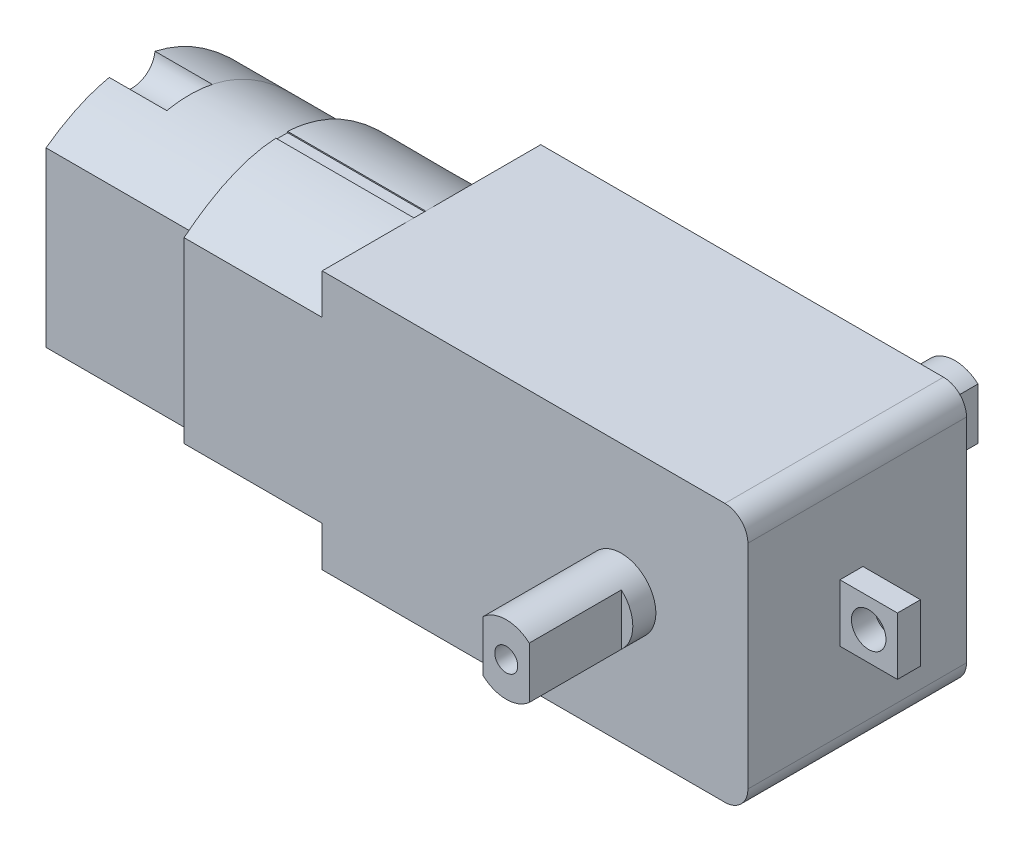
from build123d import *
from build123d.topology import SkipClean

# Parameters (mm, degrees)
ESQUISSE1_W             = 37
ESQUISSE1_H             = 19
BOSS_EXTRU_1_DEPTH      = 22.5
ESQUISSE2_W             = 2
ESQUISSE2_H             = 2.5
BOSS_EXTRU_2_DEPTH      = 5
ESQUISSE3_R             = 1.5
ENL_V_MAT_EXTRU_1_DEPTH = 2.410935021
BOSS_EXTRU_3_DEPTH      = 12
BOSS_EXTRU_4_DEPTH      = 8
BOSS_EXTRU_5_DEPTH      = 5
BOSS_EXTRU_6_DEPTH      = 2
BOSS_EXTRU_8_DEPTH      = 1
ENL_V_MAT_EXTRU_2_DEPTH = 1
BOSS_EXTRU_11_DEPTH     = 10
ENL_V_START             = -8
ENL_V_MAT_EXTRU_3_DEPTH = 8
ESQUISSE20_R            = 1
ENL_V_MAT_EXTRU_4_DEPTH = 12
BOSS_EXTRU_12_START     = 10
ESQUISSE21_R            = 3
BOSS_EXTRU_12_DEPTH     = 10
ENL_V_START_2           = -12
ESQUISSE22_R            = 1
ENL_V_MAT_EXTRU_5_DEPTH = 12
ENL_V_MAT_EXTRU_6_DEPTH = 8
CONG_1_R                = 2
CONG_2_R                = 2
ESQUISSE25_W            = 12
ESQUISSE25_H            = 1.024916904
ENL_V_MAT_EXTRU_8_DEPTH = 0.1
ESQUISSE26_W            = 12
ESQUISSE26_H            = 1.024916904
ENL_V_MAT_EXTRU_9_DEPTH = 0.1


with BuildPart() as part:
    # Esquisse1 → Boss.-Extru.1 (new body)
    with BuildSketch(Plane(origin=(0, 0, 0), x_dir=(1, 0, 0), z_dir=(0, 1, 0))):
        with Locations((18.5, 9.5)):
            Rectangle(ESQUISSE1_W, ESQUISSE1_H)
    extrude(amount=BOSS_EXTRU_1_DEPTH)

    # Esquisse2 → Boss.-Extru.2 (add)
    with BuildSketch(Plane(origin=(37, 0, 0), x_dir=(0, 0, -1), z_dir=(1, 0, 0))):
        with Locations((9, 10)):
            Rectangle(ESQUISSE2_W, ESQUISSE2_H)
        with Locations((9, 12.5)):
            Rectangle(ESQUISSE2_W, ESQUISSE2_H)
    extrude(amount=BOSS_EXTRU_2_DEPTH)

    # Esquisse3 → Enlèv. mat.-Extru.1 (cut)
    with BuildSketch(Plane.XY.offset(-8)):
        with Locations((39.5, 11.25)):
            Circle(ESQUISSE3_R)
    extrude(amount=-ENL_V_MAT_EXTRU_1_DEPTH, mode=Mode.SUBTRACT)

    # Esquisse4 → Boss.-Extru.3 (add)
    with BuildSketch(Plane.ZY):
        with BuildLine():
            Line((-17, 18.52996288), (-17, 17.52996288))
            add(Edge.make_bspline(
                [(-17, 17.52996288), (-13.120467928, 21.281137839), (-9, 21.5)],
                knots=[0.059122434, 0.059122434, 0.059122434, 0.5160139, 0.5160139, 0.5160139], degree=2))
            Line((-9, 21.5), (-9, 22.5))
            add(Edge.make_bspline(
                [(-17, 18.52996288), (-13.120467928, 22.281137839), (-9, 22.5)],
                knots=[0.059122434, 0.059122434, 0.059122434, 0.5160139, 0.5160139, 0.5160139], degree=2))
        make_face()
        with BuildLine():
            add(Edge.make_bspline(
                [(-9, 21.5), (-5.107506367, 21.706753112), (-1, 18.761247174)],
                knots=[0.5160139, 0.5160139, 0.5160139, 0.947626804, 0.947626804, 0.947626804], degree=2))
            Line((-1, 18.761247174), (-1, 19.761247174))
            add(Edge.make_bspline(
                [(-7.975083096, 22.5), (-4.568692956, 22.320368294), (-1, 19.761247174)],
                knots=[0.572631907, 0.572631907, 0.572631907, 0.947626804, 0.947626804, 0.947626804], degree=2))
            Line((-7.975083096, 22.5), (-9, 22.5))
            Line((-9, 22.5), (-9, 21.5))
        make_face()
        with BuildLine():
            Line((-1, 19.761247174), (-1, 18.761247174))
            add(Edge.make_bspline(
                [(-1, 18.761247174), (-0.501582937, 18.403830705), (0, 18)],
                knots=[0.947626804, 0.947626804, 0.947626804, 1, 1, 1], degree=2))
            Line((0, 18), (0, 19))
            add(Edge.make_bspline(
                [(-1, 19.761247174), (-0.501582937, 19.403830705), (0, 19)],
                knots=[0.947626804, 0.947626804, 0.947626804, 1, 1, 1], degree=2))
        make_face()
        with BuildLine():
            Line((-1, 18.761247174), (-1, 3.738752826))
            add(Edge.make_bspline(
                [(-1, 3.738752826), (-0.501582937, 4.096169295), (0, 4.5)],
                knots=[0.947626804, 0.947626804, 0.947626804, 1, 1, 1], degree=2))
            Line((0, 4.5), (0, 18))
            add(Edge.make_bspline(
                [(-1, 18.761247174), (-0.501582937, 18.403830705), (0, 18)],
                knots=[0.947626804, 0.947626804, 0.947626804, 1, 1, 1], degree=2))
        make_face()
        with BuildLine():
            Line((-9, 1), (-9, 0))
            Line((-9, 0), (-7.975083096, 0))
            add(Edge.make_bspline(
                [(-7.975083096, 0), (-4.568692956, 0.179631706), (-1, 2.738752826)],
                knots=[0.572631907, 0.572631907, 0.572631907, 0.947626804, 0.947626804, 0.947626804], degree=2))
            Line((-1, 2.738752826), (-1, 3.738752826))
            add(Edge.make_bspline(
                [(-9, 1), (-5.107506367, 0.793246888), (-1, 3.738752826)],
                knots=[0.5160139, 0.5160139, 0.5160139, 0.947626804, 0.947626804, 0.947626804], degree=2))
        make_face()
        with BuildLine():
            add(Edge.make_bspline(
                [(-1, 3.738752826), (-0.501582937, 4.096169295), (0, 4.5)],
                knots=[0.947626804, 0.947626804, 0.947626804, 1, 1, 1], degree=2))
            Line((-1, 3.738752826), (-1, 2.738752826))
            add(Edge.make_bspline(
                [(-1, 2.738752826), (-0.501582937, 3.096169295), (0, 3.5)],
                knots=[0.947626804, 0.947626804, 0.947626804, 1, 1, 1], degree=2))
            Line((0, 3.5), (0, 4.5))
        make_face()
        with BuildLine():
            add(Edge.make_bspline(
                [(-17, 3.97003712), (-13.120467928, 0.218862161), (-9, 0)],
                knots=[0.059122434, 0.059122434, 0.059122434, 0.5160139, 0.5160139, 0.5160139], degree=2))
            Line((-9, 0), (-9, 1))
            add(Edge.make_bspline(
                [(-17, 4.97003712), (-13.120467928, 1.218862161), (-9, 1)],
                knots=[0.059122434, 0.059122434, 0.059122434, 0.5160139, 0.5160139, 0.5160139], degree=2))
            Line((-17, 4.97003712), (-17, 3.97003712))
        make_face()
        with BuildLine():
            Line((-18, 6), (-18, 5))
            add(Edge.make_bspline(
                [(-18, 5), (-17.502017205, 4.455444723), (-17, 3.97003712)],
                knots=[0, 0, 0, 0.059122434, 0.059122434, 0.059122434], degree=2))
            Line((-17, 3.97003712), (-17, 4.97003712))
            add(Edge.make_bspline(
                [(-18, 6), (-17.502017205, 5.455444723), (-17, 4.97003712)],
                knots=[0, 0, 0, 0.059122434, 0.059122434, 0.059122434], degree=2))
        make_face()
        with BuildLine():
            Line((-18, 16.5), (-18, 6))
            add(Edge.make_bspline(
                [(-18, 6), (-17.502017205, 5.455444723), (-17, 4.97003712)],
                knots=[0, 0, 0, 0.059122434, 0.059122434, 0.059122434], degree=2))
            Line((-17, 4.97003712), (-17, 17.52996288))
            add(Edge.make_bspline(
                [(-18, 16.5), (-17.502017205, 17.044555277), (-17, 17.52996288)],
                knots=[0, 0, 0, 0.059122434, 0.059122434, 0.059122434], degree=2))
        make_face()
        with BuildLine():
            Line((-18, 17.5), (-18, 16.5))
            add(Edge.make_bspline(
                [(-18, 16.5), (-17.502017205, 17.044555277), (-17, 17.52996288)],
                knots=[0, 0, 0, 0.059122434, 0.059122434, 0.059122434], degree=2))
            Line((-17, 17.52996288), (-17, 18.52996288))
            add(Edge.make_bspline(
                [(-18, 17.5), (-17.502017205, 18.044555277), (-17, 18.52996288)],
                knots=[0, 0, 0, 0.059122434, 0.059122434, 0.059122434], degree=2))
        make_face()
    extrude(amount=BOSS_EXTRU_3_DEPTH)

    # Esquisse15 → Boss.-Extru.11 (add)
    with BuildSketch(Plane(origin=(0, 0, -19), x_dir=(-1, 0, 0), z_dir=(0, 0, -1))):
        with BuildLine():
            Line((-27.1, 14.041057147), (-27.1, 11.25))
            Line((-27.1, 11.25), (-26, 11.25))
            Line((-26, 11.25), (-24.9, 11.25))
            Line((-24.9, 11.25), (-24.9, 14.041057147))
            ThreePointArc((-24.9, 14.041057147), (-26, 14.25), (-27.1, 14.041057147))
        make_face()
        with BuildLine():
            Line((-26, 11.25), (-27.1, 11.25))
            Line((-27.1, 11.25), (-27.1, 8.458942853))
            ThreePointArc((-27.1, 8.458942853), (-26, 8.25), (-24.9, 8.458942853))
            Line((-24.9, 8.458942853), (-24.9, 11.25))
            Line((-24.9, 11.25), (-26, 11.25))
        make_face()
        with BuildLine():
            ThreePointArc((-23, 11.25), (-23.520080646, 12.938194302), (-24.9, 14.041057147))
            Line((-24.9, 14.041057147), (-24.9, 11.25))
            Line((-24.9, 11.25), (-24.9, 8.458942853))
            ThreePointArc((-24.9, 8.458942853), (-23.520080646, 9.561805698), (-23, 11.25))
        make_face()
        with BuildLine():
            ThreePointArc((-27.1, 14.041057147), (-28.479919354, 12.938194302), (-29, 11.25))
            Line((-29, 11.25), (-27.1, 11.25))
            Line((-27.1, 11.25), (-27.1, 14.041057147))
        make_face()
        with BuildLine():
            Line((-27.1, 11.25), (-29, 11.25))
            ThreePointArc((-29, 11.25), (-28.479919354, 9.561805698), (-27.1, 8.458942853))
            Line((-27.1, 8.458942853), (-27.1, 11.25))
        make_face()
    extrude(amount=BOSS_EXTRU_11_DEPTH)

    # Esquisse19 → Enlèv. mat.-Extru.3 (cut)
    with BuildSketch(Plane(origin=(0, 0, -29), x_dir=(-1, 0, 0), z_dir=(0, 0, -1)).offset(ENL_V_START)):
        with BuildLine():
            ThreePointArc((-23, 11.25), (-23.261387212, 12.474744871), (-24, 13.486067977))
            Line((-24, 13.486067977), (-24, 9.013932023))
            ThreePointArc((-24, 9.013932023), (-23.261387212, 10.025255129), (-23, 11.25))
        make_face()
        with BuildLine():
            Line((-28, 9.013932023), (-28, 13.486067977))
            ThreePointArc((-28, 13.486067977), (-29, 11.25), (-28, 9.013932023))
        make_face()
    extrude(amount=ENL_V_MAT_EXTRU_3_DEPTH, mode=Mode.SUBTRACT)

    # Esquisse20 → Enlèv. mat.-Extru.4 (cut)
    with BuildSketch(Plane(origin=(0, 0, -29), x_dir=(-1, 0, 0), z_dir=(0, 0, -1))):
        with Locations((-26, 11.25)):
            Circle(ESQUISSE20_R)
    extrude(amount=-ENL_V_MAT_EXTRU_4_DEPTH, mode=Mode.SUBTRACT)

    # Esquisse21 → Boss.-Extru.12 (add)
    with BuildSketch(Plane.XY.offset(BOSS_EXTRU_12_START)):
        with Locations((26, 11.25)):
            Circle(ESQUISSE21_R)
    extrude(amount=-BOSS_EXTRU_12_DEPTH)

    # Esquisse22 → Enlèv. mat.-Extru.5 (cut)
    with BuildSketch(Plane.XY.offset(10).offset(ENL_V_START_2)):
        with Locations(Location((26, 11.25, 0), (0, 0, 180))):
            Circle(ESQUISSE22_R)
    extrude(amount=ENL_V_MAT_EXTRU_5_DEPTH, mode=Mode.SUBTRACT)

    # Esquisse23 → Enlèv. mat.-Extru.6 (cut)
    with BuildSketch(Plane.XY.offset(10)):
        with BuildLine():
            Line((28, 13.486067977), (28, 11.25))
            Line((28, 11.25), (28, 9.013932023))
            ThreePointArc((28, 9.013932023), (28.738612788, 10.025255129), (29, 11.25))
            ThreePointArc((29, 11.25), (28.738612788, 12.474744871), (28, 13.486067977))
        make_face()
        with BuildLine():
            Line((24, 9.013932023), (24, 11.25))
            Line((24, 11.25), (24, 13.486067977))
            ThreePointArc((24, 13.486067977), (23, 11.25), (24, 9.013932023))
        make_face()
    extrude(amount=-ENL_V_MAT_EXTRU_6_DEPTH, mode=Mode.SUBTRACT)

    # Congé1
    cong_1_edges = [part.edges().sort_by_distance(p)[0] for p in [
        (37, 22.5, -9.5),
    ]]
    fillet(cong_1_edges, radius=CONG_1_R)

    # Congé2
    cong_2_edges = [part.edges().sort_by_distance(p)[0] for p in [
        (37, 0, -9.5),
    ]]
    fillet(cong_2_edges, radius=CONG_2_R)

    # Esquisse25 → Enlèv. mat.-Extru.8 (cut)
    with BuildSketch(Plane.XZ):
        with Locations((-6, -8.487541548)):
            Rectangle(ESQUISSE25_W, ESQUISSE25_H)
    extrude(amount=-ENL_V_MAT_EXTRU_8_DEPTH, mode=Mode.SUBTRACT)

    # Esquisse26 → Enlèv. mat.-Extru.9 (cut)
    with BuildSketch(Plane(origin=(0, 22.5, 0), x_dir=(1, 0, 0), z_dir=(0, 1, 0))):
        with Locations((-6, 8.487541548)):
            Rectangle(ESQUISSE26_W, ESQUISSE26_H)
    extrude(amount=-ENL_V_MAT_EXTRU_9_DEPTH, mode=Mode.SUBTRACT)


with BuildPart() as body_2:
    # Esquisse9 → Boss.-Extru.4 (new body)
    with BuildSketch(Plane.ZY.offset(12)):
        with BuildLine():
            add(Edge.make_bspline(
                [(-1, 18.761247174), (-9.455579824, 24.82477048), (-17, 17.52996288)],
                knots=[0.544374, 0.544374, 0.544374, 1.43287837, 1.43287837, 1.43287837], degree=2))
            Line((-17, 17.52996288), (-17, 4.97003712))
            add(Edge.make_bspline(
                [(-17, 4.97003712), (-9.455579824, -2.32477048), (-1, 3.738752826)],
                knots=[0.059122434, 0.059122434, 0.059122434, 0.947626804, 0.947626804, 0.947626804], degree=2))
            Line((-1, 3.738752826), (-1, 18.761247174))
        make_face()
    extrude(amount=BOSS_EXTRU_4_DEPTH)

    # Esquisse10 → Boss.-Extru.5 (add)
    with BuildSketch(Plane.ZY.offset(20)):
        with BuildLine():
            add(Edge.make_bspline(
                [(-1, 18.761247174), (-3.797616827, 20.767427138), (-6.495490257, 21.311288945)],
                knots=[0.544374, 0.544374, 0.544374, 0.838344943, 0.838344943, 0.838344943], degree=2))
            add(Edge.make_bspline(
                [(-6.495490257, 21.311288945), (-6.496620171, 21.311516723), (-6.497750067, 21.311744245)],
                knots=[0.838344943, 0.838344943, 0.838344943, 0.838468063, 0.838468063, 0.838468063], degree=2))
            ThreePointArc((-6.497750067, 21.311744245), (-8.4763836, 19.513591784), (-10.474957342, 21.289555163))
            add(Edge.make_bspline(
                [(-17.000000003, 17.529962878), (-13.787011803, 20.568477856), (-10.474957342, 21.289555163)],
                knots=[0, 0, 0, 0.416489775, 0.416489775, 0.416489775], degree=2))
            Line((-17, 17.52996288), (-17, 11.25))
            Line((-17, 11.25), (-17, 4.970037121))
            add(Edge.make_bspline(
                [(-17, 4.970037125), (-13.788104816, 1.932555806), (-10.47721076, 1.210935706)],
                knots=[0, 0, 0, 0.416348091, 0.416348091, 0.416348091], degree=2))
            ThreePointArc((-10.47721076, 1.210935706), (-8.476365575, 2.988702384), (-6.495490257, 1.188711053))
            add(Edge.make_bspline(
                [(-6.495490257, 1.188711055), (-3.797616827, 1.732572862), (-1, 3.738752826)],
                knots=[0.653655861, 0.653655861, 0.653655861, 0.947626804, 0.947626804, 0.947626804], degree=2))
            Line((-1, 3.738752825), (-1.000000001, 11.25))
            Line((-1.000000001, 11.25), (-1.000000001, 18.761247174))
        make_face()
    extrude(amount=BOSS_EXTRU_5_DEPTH)

    # Esquisse11 → Boss.-Extru.6 (add)
    with BuildSketch(Plane.ZY.offset(25)):
        with BuildLine():
            Line((-12.000000003, 14.798549504), (-12.000000003, 11.25))
            Line((-12.000000003, 11.25), (-12.000000003, 7.703744664))
            ThreePointArc((-12.000000003, 7.703744664), (-6.555193581, 6.634972961), (-3.476374588, 11.251147084))
            ThreePointArc((-3.476374588, 11.251147084), (-6.555193581, 15.867321208), (-12.000000003, 14.798549504))
        make_face()
    extrude(amount=BOSS_EXTRU_6_DEPTH)

    # Esquisse13 → Boss.-Extru.8 (add)
    with BuildSketch(Plane.ZY.offset(27)):
        with BuildLine():
            ThreePointArc((-9.487541548, 11.25), (-9.194648329, 10.542893219), (-8.487541548, 10.25))
            Line((-8.487541548, 10.25), (-8.487541548, 11.25))
            Line((-8.487541548, 11.25), (-9.487541548, 11.25))
        make_face()
        with BuildLine():
            Line((-8.487541548, 11.25), (-8.487541548, 10.25))
            ThreePointArc((-8.487541548, 10.25), (-7.780434767, 10.542893219), (-7.487541548, 11.25))
            Line((-7.487541548, 11.25), (-8.487541548, 11.25))
        make_face()
        with BuildLine():
            Line((-9.487541548, 11.25), (-8.487541548, 11.25))
            Line((-8.487541548, 11.25), (-8.487541548, 12.25))
            ThreePointArc((-8.487541548, 12.25), (-9.194648329, 11.957106781), (-9.487541548, 11.25))
        make_face()
        with BuildLine():
            Line((-8.487541548, 12.25), (-8.487541548, 11.25))
            Line((-8.487541548, 11.25), (-7.487541548, 11.25))
            ThreePointArc((-7.487541548, 11.25), (-7.780434767, 11.957106781), (-8.487541548, 12.25))
        make_face()
    extrude(amount=BOSS_EXTRU_8_DEPTH)

    # Esquisse14 → Enlèv. mat.-Extru.2 (cut)
    with SkipClean():  # the faces are left unmerged after this step: merging them gives an invalid solid
        with BuildSketch(Plane.ZY.offset(27)):
            with BuildLine():
                ThreePointArc((-8.487541548, 12.25), (-7.780434767, 11.957106781), (-7.487541548, 11.25))
                Line((-7.487541548, 11.25), (-6.487541548, 11.25))
                ThreePointArc((-6.487541548, 11.25), (-7.073327985, 12.664213562), (-8.487541548, 13.25))
                Line((-8.487541548, 13.25), (-8.487541548, 12.25))
            make_face()
            with BuildLine():
                Line((-6.487541548, 11.25), (-7.487541548, 11.25))
                ThreePointArc((-7.487541548, 11.25), (-7.780434767, 10.542893219), (-8.487541548, 10.25))
                Line((-8.487541548, 10.25), (-8.487541548, 9.25))
                ThreePointArc((-8.487541548, 9.25), (-7.073327985, 9.835786438), (-6.487541548, 11.25))
            make_face()
            with BuildLine():
                ThreePointArc((-9.487541548, 11.25), (-9.194648329, 11.957106781), (-8.487541548, 12.25))
                Line((-8.487541548, 12.25), (-8.487541548, 13.25))
                ThreePointArc((-8.487541548, 13.25), (-9.90175511, 12.664213562), (-10.487541548, 11.25))
                Line((-10.487541548, 11.25), (-9.487541548, 11.25))
            make_face()
            with BuildLine():
                Line((-8.487541548, 9.25), (-8.487541548, 10.25))
                ThreePointArc((-8.487541548, 10.25), (-9.194648329, 10.542893219), (-9.487541548, 11.25))
                Line((-9.487541548, 11.25), (-10.487541548, 11.25))
                ThreePointArc((-10.487541548, 11.25), (-9.90175511, 9.835786438), (-8.487541548, 9.25))
            make_face()
        extrude(amount=-ENL_V_MAT_EXTRU_2_DEPTH, mode=Mode.SUBTRACT)


solid = Compound([part.part, body_2.part])
